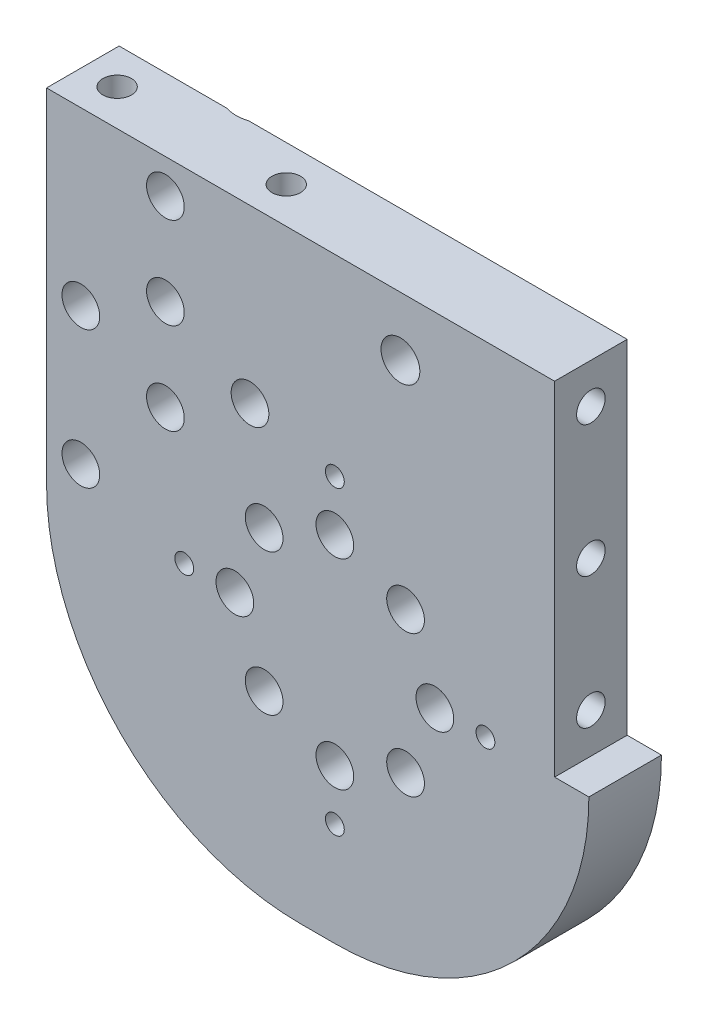
from build123d import *

# Parameters (mm, degrees)
BOSS_EXTRUDE1_DEPTH                                 = 12.7
F_4_CLEARANCE_HOLE1_D                               = 3.3
F_1_4_CLEARANCE_HOLE1_D                             = 6.6
F_1_4_CLEARANCE_HOLE2_D                             = 6.8
CSK_FOR_1_4_FLAT_HEAD_MACHINE_SCREW_100_D           = 6.6
CSK_FOR_1_4_FLAT_HEAD_MACHINE_SCREW_100_CSINK_D     = 12.6
CSK_FOR_1_4_FLAT_HEAD_MACHINE_SCREW_100_CSINK_ANGLE = 90
F_10_CLEARANCE_HOLE1_D                              = 5
F_10_CLEARANCE_HOLE1_DEPTH                          = 15
F_10_CLEARANCE_HOLE2_D                              = 5
F_10_CLEARANCE_HOLE2_DEPTH                          = 10
F_1_3_4_CLEARANCE_HOLE1_D                           = 45
F_1_3_4_CLEARANCE_HOLE1_DEPTH                       = 5
F_1_4_CLEARANCE_HOLE3_D                             = 6.6
F_1_4_CLEARANCE_HOLE3_DEPTH                         = 12.7
CHAMFER1_SIZE                                       = 3
BOSS_EXTRUDE2_DEPTH                                 = 12.7
SKETCH_1_W                                          = 126.874345958
SKETCH_1_H                                          = 130.303382335
CUT_EXTRUDE_1_DEPTH                                 = 153.24885057
SKETCH_4_W                                          = 119.865204769
SKETCH_4_H                                          = 136.067011153
CUT_EXTRUDE_3_DEPTH                                 = 153.24885057


with BuildPart() as part:
    # Sketch1 → Boss-Extrude1 (new body)
    with BuildSketch(Plane(origin=(0, 0, 0), x_dir=(-1, 0, 0), z_dir=(0, 0, -1))):
        with BuildLine():
            Line((44.45, 0), (44.45, 60))
            Line((44.45, 60), (-44.45, 60))
            Line((-44.45, 60), (-44.45, 0))
            ThreePointArc((-44.45, 0), (0, -44.45), (44.45, 0))
        make_face()
    extrude(amount=-BOSS_EXTRUDE1_DEPTH)

    # #4 Clearance Hole1 (through all)
    with Locations(Plane.XY.offset(12.7)):
        with Locations((32.349998458, 0.009014041), (6, -26.35), (-20.349998115, -0.009967087), (6, 26.35)):
            Hole(F_4_CLEARANCE_HOLE1_D / 2)

    # 1/4 Clearance Hole1 (through all)
    with Locations(Plane(origin=(0, 0, 0), x_dir=(-1, 0, 0), z_dir=(0, 0, -1))):
        with Locations((8.85, 30), (23.65, 38), (23.65, 22)):
            Hole(F_1_4_CLEARANCE_HOLE1_D / 2)

    # 1/4 Clearance Hole2 (through all)
    with Locations(Plane.XY.offset(12.7)):
        with Locations((17.47250377, 49.692873304)):
            Hole(F_1_4_CLEARANCE_HOLE2_D / 2)

    # CSK for 1/4 Flat Head Machine Screw (100)1 (through all)
    with Locations(Plane(origin=(0, 0, 0), x_dir=(-1, 0, 0), z_dir=(0, 0, -1))):
        with Locations((23.65, 54), (38.45, 6), (38.45, 30)):
            CounterSinkHole(CSK_FOR_1_4_FLAT_HEAD_MACHINE_SCREW_100_D / 2, CSK_FOR_1_4_FLAT_HEAD_MACHINE_SCREW_100_CSINK_D / 2, counter_sink_angle=CSK_FOR_1_4_FLAT_HEAD_MACHINE_SCREW_100_CSINK_ANGLE)

    # #10 Clearance Hole1
    with Locations(Plane(origin=(0, 60, 0), x_dir=(1, 0, 0), z_dir=(0, 1, 0))):
        with Locations((-38.45, -6.35), (-8.85, -6.35)):
            Hole(F_10_CLEARANCE_HOLE1_D / 2, depth=F_10_CLEARANCE_HOLE1_DEPTH)

    # #10 Clearance Hole2
    with Locations(Plane(origin=(44.45, 0, 0), x_dir=(0, 0, -1), z_dir=(1, 0, 0))):
        with Locations((-6.35, 7), (-6.35, 53), (-6.35, 30)):
            Hole(F_10_CLEARANCE_HOLE2_D / 2, depth=F_10_CLEARANCE_HOLE2_DEPTH)

    # 1-3/4 Clearance Hole1
    with Locations(Plane(origin=(0, 0, 0), x_dir=(-1, 0, 0), z_dir=(0, 0, -1))):
        with Locations((-6, 0)):
            Hole(F_1_3_4_CLEARANCE_HOLE1_D / 2, depth=F_1_3_4_CLEARANCE_HOLE1_DEPTH)

    # 1/4 Clearance Hole3
    with Locations(Plane.XY.offset(12.7)):
        with Locations((18.374368671, 12.374368671), (23.499999956, -0.001247108), (18.374368671, -12.374368671), (6, -17.5), (-6.374368671, -12.374368671), (-11.5, 0), (-6.374368671, 12.374368671), (6, 17.5)):
            Hole(F_1_4_CLEARANCE_HOLE3_D / 2, depth=F_1_4_CLEARANCE_HOLE3_DEPTH)

    # Chamfer1
    chamfer1_edges = [part.edges().sort_by_distance(p)[0] for p in [
        (-26.95, 22, 0),
        (-26.95, 38, 0),
        (-12.15, 30, 0),
    ]]
    chamfer(chamfer1_edges, length=CHAMFER1_SIZE)

    # Sketch18 → Boss-Extrude2 (add)
    with BuildSketch(Plane(origin=(0, 0, 0), x_dir=(-1, 0, 0), z_dir=(0, 0, -1))):
        with BuildLine():
            Line((-44.45, 0), (-50.45, 0))
            ThreePointArc((-50.45, 0), (-37.430896424, -31.430896424), (-6, -44.45))
            Line((-6, -44.45), (0, -44.45))
            ThreePointArc((0, -44.45), (-31.430896424, -31.430896424), (-44.45, 0))
        make_face()
    extrude(amount=-BOSS_EXTRUDE2_DEPTH)

    # 镜向1: part across plane


with BuildPart() as part_1:
    add(part.part)
    add(part.part.mirror(Plane(origin=(-44.45, 0, 12.7), x_dir=(0, 0, 1), z_dir=(-1, 0, 0))))

    # 草图1 → 切除-拉伸1 (cut, through all)
    with BuildSketch(Plane(origin=(0, 0, 0), x_dir=(-1, 0, 0), z_dir=(0, 0, -1))):
        with Locations((-18.987172979, 5.0519417)):
            Rectangle(SKETCH_1_W, SKETCH_1_H)
    extrude(amount=-CUT_EXTRUDE_1_DEPTH, mode=Mode.SUBTRACT)

    # 镜向3: part across plane


with BuildPart() as part_2:
    add(part_1.part)
    add(part_1.part.mirror(Plane(origin=(-44.45, 70.203632868, 12.7), x_dir=(0, 0, 1), z_dir=(-1, 0, 0))))

    # 草图4 → 切除-拉伸3 (cut, through all)
    with BuildSketch(Plane.XY.offset(12.7)):
        with Locations((-104.382602385, 0.979374439)):
            Rectangle(SKETCH_4_W, SKETCH_4_H)
    extrude(amount=-CUT_EXTRUDE_3_DEPTH, mode=Mode.SUBTRACT)


solid = part_2.part
